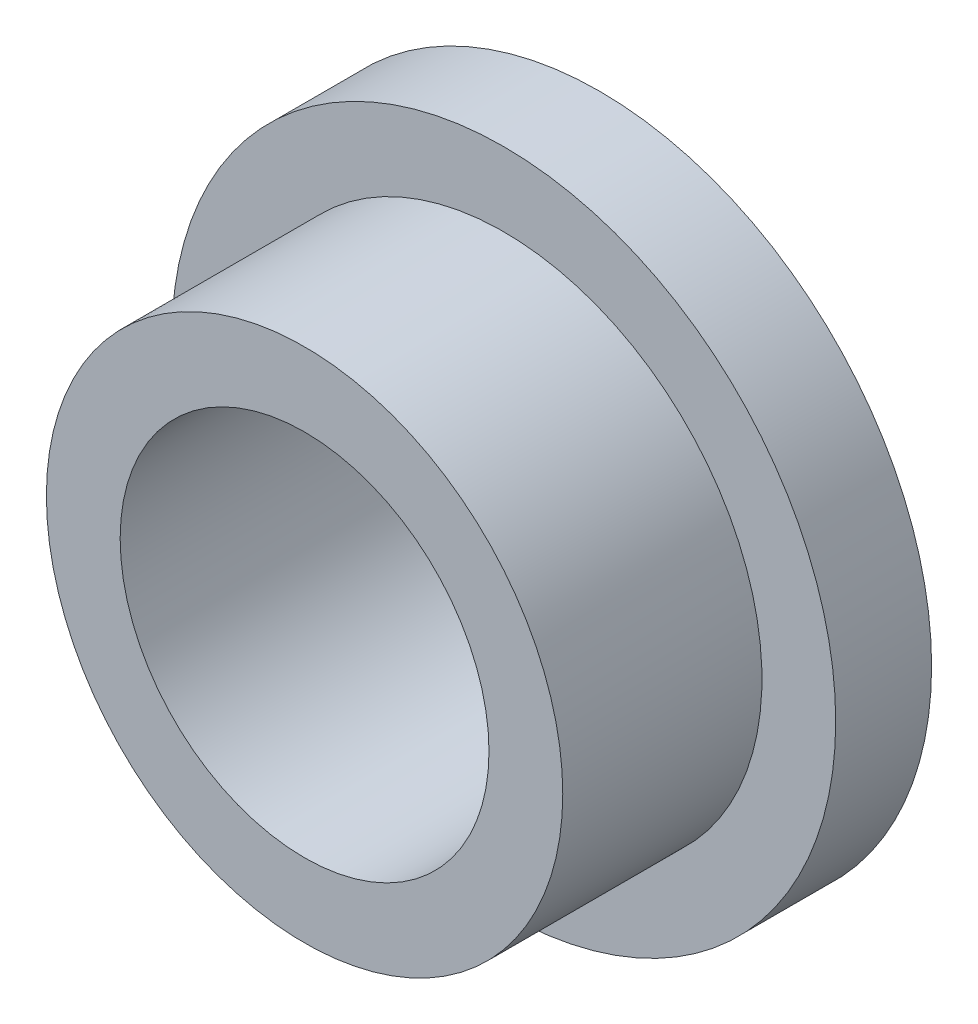
from build123d import *

# Parameters (mm, degrees)
SKETCH_1_R      = 10.5
SKETCH_1_R_2    = 7.5
EXTRUDE_1_DEPTH = 12
SKETCH_2_R      = 13.5
SKETCH_2_R_2    = 10.5
EXTRUDE_2_DEPTH = 3.9


with BuildPart() as part:
    # 草图1 → 拉伸-薄壁1 (new body)
    with BuildSketch(Plane.XY):
        Circle(SKETCH_1_R)
        Circle(SKETCH_1_R_2, mode=Mode.SUBTRACT)
    extrude(amount=EXTRUDE_1_DEPTH)

    # 草图2 → 拉伸-薄壁2 (add)
    with BuildSketch(Plane(origin=(0, 0, 0), x_dir=(-1, 0, 0), z_dir=(0, 0, -1))):
        Circle(SKETCH_2_R)
        Circle(SKETCH_2_R_2, mode=Mode.SUBTRACT)
    extrude(amount=-EXTRUDE_2_DEPTH)


solid = part.part
